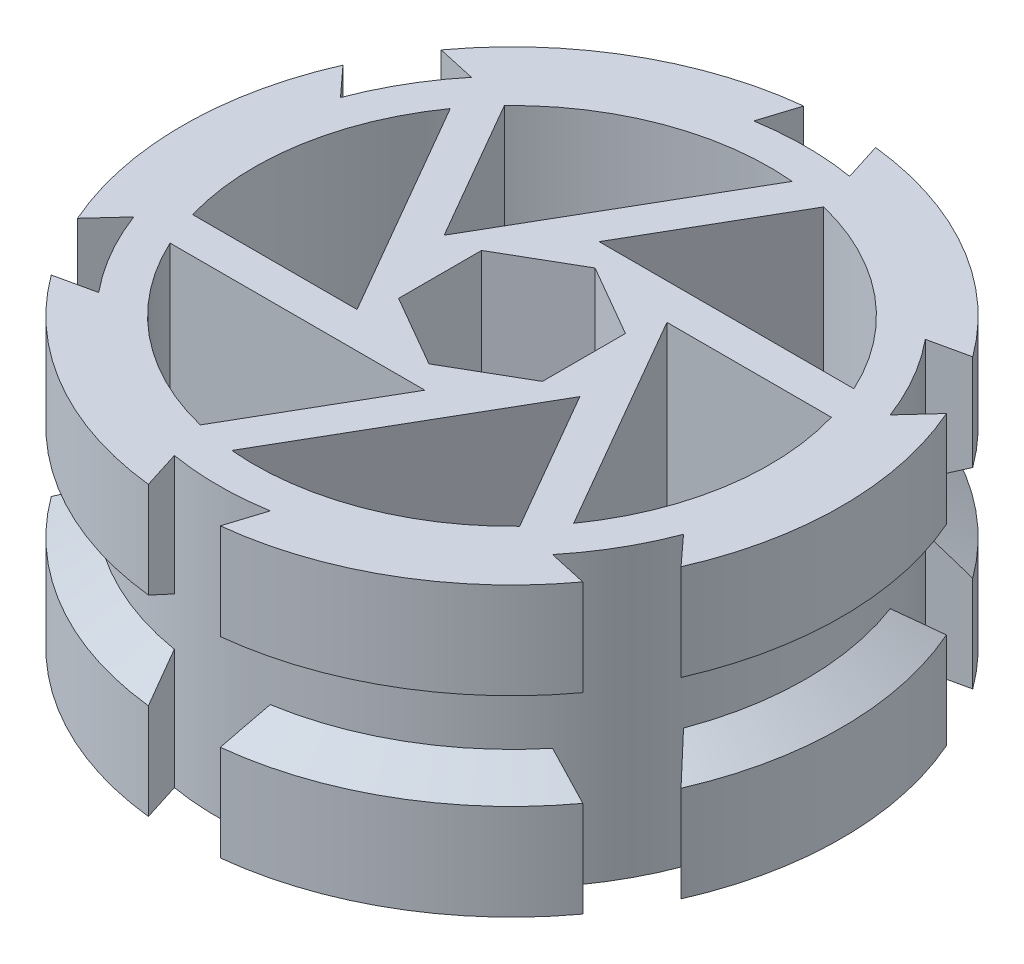
from build123d import *
from build123d.topology import SkipClean

# Parameters (mm, degrees)
SKETCH1_R           = 27.5
BOSS_EXTRUDE1_DEPTH = 24
CUT_EXTRUDE3_START  = -2
CUT_EXTRUDE3_DEPTH  = 48.700109409
CIRPATTERN1_COUNT   = 6
CUT_EXTRUDE4_DEPTH  = 24
CIRPATTERN2_COUNT   = 6
CUT_EXTRUDE5_DEPTH  = 8.8
SKETCH6_R           = 1.9
CUT_EXTRUDE6_DEPTH  = 24


with BuildPart() as part:
    # Sketch1 → Boss-Extrude1 (new body)
    with BuildSketch(Plane(origin=(0, 0, 0), x_dir=(1, 0, 0), z_dir=(0, 1, 0))):
        with Locations(Location((0, 0, 0), (0, 0, 270))):
            Circle(SKETCH1_R)
    extrude(amount=BOSS_EXTRUDE1_DEPTH)

    # Sketch2 → Cut-Extrude3 (cut)
    with BuildSketch(Plane(origin=(0, 0, 0), x_dir=(1, 0, 0), z_dir=(0, 1, 0)).offset(CUT_EXTRUDE3_START)):
        with BuildLine():
            Line((-3, 27.335873866), (-4, 24.171263931))
            ThreePointArc((-4, 24.171263931), (0, 24.5), (4, 24.171263931))
            Line((4, 24.171263931), (3, 27.335873866))
            ThreePointArc((3, 27.335873866), (0, 27.5), (-3, 27.335873866))
        make_face()
    cut_extrude3 = extrude(amount=CUT_EXTRUDE3_DEPTH, mode=Mode.SUBTRACT)

    # CirPattern1: Cut-Extrude3 ×6 about axis
    cirpattern1_axis = Axis((0, 0, 0), (0, 1, 0))
    for i in range(1, CIRPATTERN1_COUNT):
        add(cut_extrude3.rotate(cirpattern1_axis, i * 360 / CIRPATTERN1_COUNT), mode=Mode.SUBTRACT)

    # Sketch3 → Cut-Extrude4 (cut)
    with BuildSketch(Plane(origin=(0, 0, 0), x_dir=(1, 0, 0), z_dir=(0, 1, 0))):
        with BuildLine():
            ThreePointArc((19.52562419, 9), (13.682742888, 16.584105253), (5.126758988, 20.879807046))
            Line((5.126758988, 20.879807046), (-1.732050808, 9))
            Line((-1.732050808, 9), (19.52562419, 9))
        make_face()
    cut_extrude4 = extrude(amount=CUT_EXTRUDE4_DEPTH, mode=Mode.SUBTRACT)

    # CirPattern2: Cut-Extrude4 ×6 about axis
    cirpattern2_axis = Axis((0, 0, 0), (0, 1, 0))
    for i in range(1, CIRPATTERN2_COUNT):
        add(cut_extrude4.rotate(cirpattern2_axis, i * 360 / CIRPATTERN2_COUNT), mode=Mode.SUBTRACT)

    # Sketch5 → Cut-Extrude5 (cut)
    with BuildSketch(Plane(origin=(0, 24, 0), x_dir=(1, 0, 0), z_dir=(0, 1, 0))):
        Polygon((0, 6.92820323), (-6, 3.464101615), (-6, -3.464101615), (0, -6.92820323), (6, -3.464101615), (6, 3.464101615), align=None)
    cut_extrude5 = extrude(amount=-CUT_EXTRUDE5_DEPTH, mode=Mode.SUBTRACT)

    # Sketch6 → Cut-Extrude6 (cut)
    with BuildSketch(Plane(origin=(0, 0, 0), x_dir=(1, 0, 0), z_dir=(0, 1, 0))):
        with Locations(Location((0, 0, 0), (0, 0, 270))):
            Circle(SKETCH6_R)
    extrude(amount=CUT_EXTRUDE6_DEPTH, mode=Mode.SUBTRACT)

    # Mirror1: Cut-Extrude5 across plane
    add(cut_extrude5.mirror(Plane.ZX.offset(12)), mode=Mode.SUBTRACT)

    # Sketch7 → Cut-Revolve1 (revolve, cut)
    with SkipClean():  # the faces are left unmerged after this step: merging them gives an invalid solid
        with BuildSketch(Plane.XY, mode=Mode.PRIVATE) as cut_revolve1_sk:
            Polygon((24.5, 12), (24.5, 14), (27.5, 16), (27.5, 12), align=None)
        cut_revolve1 = revolve(cut_revolve1_sk.sketch.rotate(Axis((0, 24, 0), (0, -1, 0)), 270), axis=Axis((0, 24, 0), (0, -1, 0)), mode=Mode.SUBTRACT)

    # Mirror2: Cut-Revolve1 across plane
    with SkipClean():  # the faces are left unmerged after this step: merging them gives an invalid solid
        add(cut_revolve1.mirror(Plane.ZX.offset(12)), mode=Mode.SUBTRACT)


solid = part.part
